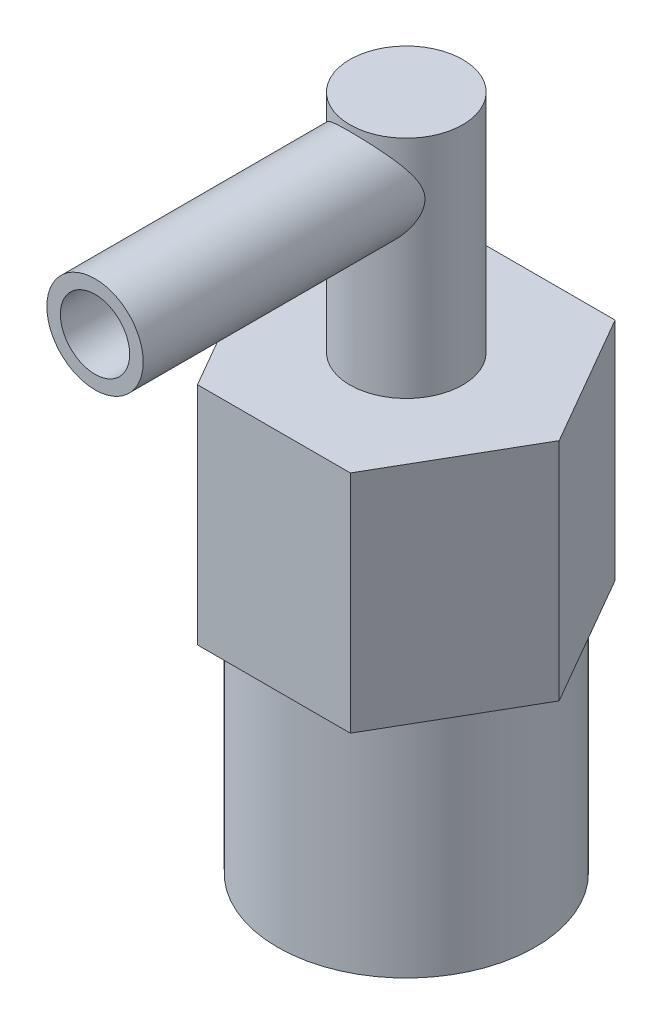
from build123d import *

# Parameters (mm, degrees)
SKETCH1_R           = 4.7625
SKETCH1_R_2         = 3.175
BOSS_EXTRUDE1_DEPTH = 8.3312
BOSS_EXTRUDE2_DEPTH = 8.3312
SKETCH3_R           = 2.0875
SKETCH3_R_2         = 1.5875
BOSS_EXTRUDE3_DEPTH = 8.3312
SKETCH4_R           = 2.0875
BOSS_EXTRUDE4_DEPTH = 0.001
SKETCH5_R           = 1.78
SKETCH5_R_2         = 1.28
BOSS_EXTRUDE5_DEPTH = 11.5062


with BuildPart() as part:
    # Sketch1 → Boss-Extrude1 (new body)
    with BuildSketch(Plane(origin=(0, 0, 0), x_dir=(1, 0, 0), z_dir=(0, 1, 0))):
        with Locations(Location((0, 0, 0), (0, 0, 270))):
            Circle(SKETCH1_R)
        with Locations(Location((0, 0, 0), (0, 0, 270))):
            Circle(SKETCH1_R_2, mode=Mode.SUBTRACT)
    extrude(amount=BOSS_EXTRUDE1_DEPTH)

    # Sketch2 → Boss-Extrude2 (add)
    with BuildSketch(Plane(origin=(0, 8.3312, 0), x_dir=(1, 0, 0), z_dir=(0, 1, 0))):
        Polygon((5.65061043, 0), (2.825305215, 4.893572179), (-2.825305215, 4.893572179), (-5.65061043, 0), (-2.825305215, -4.893572179), (2.825305215, -4.893572179), align=None)
    extrude(amount=BOSS_EXTRUDE2_DEPTH)

    # Sketch3 → Boss-Extrude3 (add)
    with BuildSketch(Plane(origin=(0, 16.6624, 0), x_dir=(1, 0, 0), z_dir=(0, 1, 0))):
        with Locations(Location((0, 0, 0), (0, 0, 270))):
            Circle(SKETCH3_R)
        with Locations(Location((0, 0, 0), (0, 0, 270))):
            Circle(SKETCH3_R_2, mode=Mode.SUBTRACT)
    extrude(amount=BOSS_EXTRUDE3_DEPTH)

    # Sketch4 → Boss-Extrude4 (add)
    with BuildSketch(Plane(origin=(0, 24.9936, 0), x_dir=(1, 0, 0), z_dir=(0, 1, 0))):
        with Locations(Location((0, 0, 0), (0, 0, 270))):
            Circle(SKETCH4_R)
    extrude(amount=BOSS_EXTRUDE4_DEPTH)

    # Sketch5 → Boss-Extrude5 (add)
    with BuildSketch(Plane.XY):
        with Locations(Location((0, 22.9946, 0), (0, 0, 180))):
            Circle(SKETCH5_R)
        with Locations(Location((0, 22.9946, 0), (0, 0, 180))):
            Circle(SKETCH5_R_2, mode=Mode.SUBTRACT)
    extrude(amount=BOSS_EXTRUDE5_DEPTH)


solid = part.part
